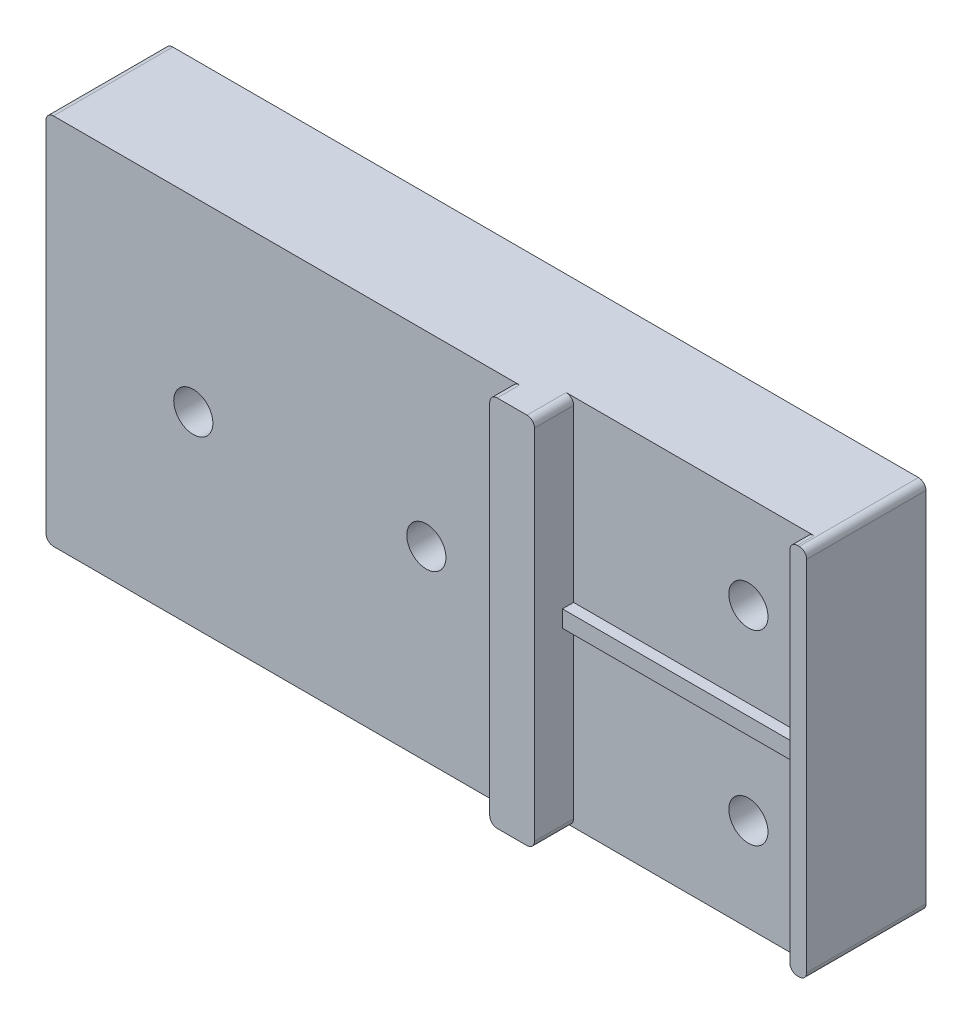
from build123d import *

# Parameters (mm, degrees)
BOSS_EXTRUDE1_DEPTH = 40
SKETCH6_R           = 2.1
CUT_EXTRUDE4_DEPTH  = 12.8
CUT_EXTRUDE7_REACH  = 60.186
SKETCH10_R          = 2.1
SKETCH11_R          = 4.75
CUT_EXTRUDE8_DEPTH  = 4.5
BOSS_EXTRUDE2_START = -0.6
SKETCH12_R          = 2.1
BOSS_EXTRUDE2_DEPTH = 0.6
SKETCH13_W          = 25
SKETCH13_H          = 1.8
BOSS_EXTRUDE3_DEPTH = 1.2
FILLET1_R           = 0.8
CUT_EXTRUDE9_DEPTH  = 1.2


with BuildPart() as part:
    # Sketch1 → Boss-Extrude1 (new body)
    with BuildSketch(Plane.XZ):
        Polygon((14, 15.2), (14, 12.8), (14, 11), (39, 11), (39, 12.8), (40.8, 12.8), (40.8, 0), (-40.8, 0), (-40.8, 12.8), (9.2, 12.8), (9.2, 15.2), align=None)
    extrude(amount=BOSS_EXTRUDE1_DEPTH)

    # Sketch6 → Cut-Extrude4 (cut)
    with BuildSketch(Plane(origin=(0, 0, 0), x_dir=(-1, 0, 0), z_dir=(0, 0, -1))):
        with Locations((25, -20)):
            Circle(SKETCH6_R)
        with Locations((0, -20)):
            Circle(SKETCH6_R)
    extrude(amount=-CUT_EXTRUDE4_DEPTH, mode=Mode.SUBTRACT)

    # Sketch10 → Cut-Extrude7 (cut, up to next)
    with BuildSketch(Plane.XY.offset(11), mode=Mode.PRIVATE) as cut_extrude7_sk1:
        with Locations((32.75, -10)):
            Circle(SKETCH10_R)
    cut_extrude7_tool1 = extrude(cut_extrude7_sk1.sketch, amount=-CUT_EXTRUDE7_REACH, mode=Mode.PRIVATE) & part.part
    # Sketch10 → Cut-Extrude7 (cut, up to next)
    with BuildSketch(Plane.XY.offset(11), mode=Mode.PRIVATE) as cut_extrude7_sk2:
        with Locations((32.75, -30)):
            Circle(SKETCH10_R)
    cut_extrude7_tool2 = extrude(cut_extrude7_sk2.sketch, amount=-CUT_EXTRUDE7_REACH, mode=Mode.PRIVATE) & part.part
    add(cut_extrude7_tool1.solids().sort_by_distance((32.75, -10, 11))[0], mode=Mode.SUBTRACT)
    add(cut_extrude7_tool2.solids().sort_by_distance((32.75, -30, 11))[0], mode=Mode.SUBTRACT)

    # Sketch11 → Cut-Extrude8 (cut)
    with BuildSketch(Plane(origin=(0, 0, 0), x_dir=(-1, 0, 0), z_dir=(0, 0, -1))):
        with Locations((-32.75, -10)):
            Circle(SKETCH11_R)
        with Locations((-32.75, -30)):
            Circle(SKETCH11_R)
    extrude(amount=-CUT_EXTRUDE8_DEPTH, mode=Mode.SUBTRACT)

    # Sketch12 → Boss-Extrude2 (add)
    with BuildSketch(Plane(origin=(0, 0, 4.5), x_dir=(-1, 0, 0), z_dir=(0, 0, -1)).offset(BOSS_EXTRUDE2_START)):
        with Locations(Location((-32.75, -10, 0), (0, 0, 180))):
            Circle(SKETCH12_R)
        with Locations(Location((-32.75, -30, 0), (0, 0, 180))):
            Circle(SKETCH12_R)
    extrude(amount=BOSS_EXTRUDE2_DEPTH)

    # Sketch13 → Boss-Extrude3 (add)
    with BuildSketch(Plane.XY.offset(11)):
        with Locations((26.5, -20)):
            Rectangle(SKETCH13_W, SKETCH13_H)
    extrude(amount=BOSS_EXTRUDE3_DEPTH)

    # Fillet1
    fillet1_edges = [part.edges().sort_by_distance(p)[0] for p in [
        (39, 0, 11.9),
        (40.8, 0, 6.4),
        (-40.8, 0, 6.4),
        (9.2, 0, 14),
        (14, 0, 13.1),
        (9.2, -40, 14),
        (-40.8, -40, 6.4),
        (40.8, -40, 6.4),
        (39, -40, 11.9),
        (14, -40, 13.1),
    ]]
    fillet(fillet1_edges, radius=FILLET1_R)

    # Sketch14 → Cut-Extrude9 (cut)
    # profile 1 of 7: a face of its own
    with BuildSketch(Plane(origin=(0, 0, 0), x_dir=(-1, 0, 0), z_dir=(0, 0, -1))):
        with BuildLine():
            Line((2.18974359, -30.674379006), (1.98291266, -31.008814103))
            Line((1.98291266, -31.008814103), (0.630448718, -30.07421875))
            add(Edge.make_bspline(
                [(0.630448718, -30.07421875), (0.635713379, -30.096820612), (0.64670946, -30.144028187), (0.65664749, -30.219579036), (0.663018687, -30.301970696), (0.663732838, -30.359327882), (0.664102564, -30.389022436)],
                knots=[0, 0, 0, 0, 0.876990432, 1.831733655, 2.877460594, 4, 4, 4, 4], degree=3))
            add(Edge.make_bspline(
                [(0.664102564, -30.389022436), (0.663115444, -30.425990318), (0.661165255, -30.499025386), (0.647037, -30.606370258), (0.623220845, -30.709512524), (0.589235967, -30.808018938), (0.546419443, -30.90261282), (0.493470997, -30.992789688), (0.430661162, -31.078459827), (0.359582792, -31.159169734), (0.281993022, -31.233367561), (0.197759499, -31.297134159), (0.110227056, -31.352569561), (0.017438548, -31.396534719), (-0.078996498, -31.43238234), (-0.180506278, -31.456397832), (-0.286383613, -31.471711294), (-0.35854579, -31.473465627), (-0.395292468, -31.474358974)],
                knots=[0, 0, 0, 0, 1.049645559, 2.073717244, 3.068620023, 4.050868799, 5.0280146, 6.012614837, 7.014861962, 8.040029866, 9.063477688, 10.05771615, 11.035582925, 12.000321245, 12.968227545, 13.951753526, 14.956984712, 16, 16, 16, 16], degree=3))
            add(Edge.make_bspline(
                [(-0.395292468, -31.474358974), (-0.445437008, -31.472684855), (-0.543929321, -31.469396603), (-0.687582758, -31.441138346), (-0.823559409, -31.39549398), (-0.95080497, -31.33120542), (-1.068581476, -31.250659696), (-1.17328114, -31.152836724), (-1.26646831, -31.040663752), (-1.345169464, -30.914477232), (-1.409973743, -30.778748596), (-1.455099856, -30.635905851), (-1.484898227, -30.488881079), (-1.488119467, -30.388934103), (-1.48974359, -30.338541667)],
                knots=[0, 0, 0, 0, 1.026456071, 2.016132398, 2.986618949, 3.956550292, 4.927332038, 5.899659137, 6.882304236, 7.906435223, 8.938725503, 9.954676794, 10.968765, 12, 12, 12, 12], degree=3))
            add(Edge.make_bspline(
                [(-1.48974359, -30.338541667), (-1.48808912, -30.285831713), (-1.484822045, -30.181745547), (-1.455898624, -30.02918493), (-1.408490139, -29.883478063), (-1.343562104, -29.745818699), (-1.262466304, -29.618850891), (-1.167035571, -29.50621346), (-1.05799344, -29.409178295), (-0.936995118, -29.329235031), (-0.808120194, -29.265898381), (-0.67494459, -29.219628437), (-0.538827281, -29.191184244), (-0.446840056, -29.1876583), (-0.400901442, -29.185897436)],
                knots=[0, 0, 0, 0, 1.075197932, 2.123189704, 3.15662753, 4.195917961, 5.22152995, 6.223331757, 7.199928194, 8.190971749, 9.174546411, 10.12353229, 11.062888073, 12, 12, 12, 12], degree=3))
            add(Edge.make_bspline(
                [(-0.400901442, -29.185897436), (-0.365102769, -29.18715092), (-0.292492595, -29.189693353), (-0.182410662, -29.205186369), (-0.070740089, -29.233683557), (0.024403069, -29.263889611), (0.102726283, -29.295596851), (0.166353593, -29.323601702), (0.23313902, -29.357498353), (0.303938195, -29.395413695), (0.378676974, -29.43730524), (0.456119285, -29.485579567), (0.53836492, -29.537016701), (0.593627626, -29.574157224), (0.622035256, -29.593249199)],
                knots=[0, 0, 0, 0, 1.15294581, 2.338511124, 3.570504003, 4.860343612, 5.549269519, 6.290426943, 7.098128343, 7.959998524, 8.876605184, 9.856197529, 10.897984707, 12, 12, 12, 12], degree=3))
            Line((0.622035256, -29.593249199), (2.18974359, -30.674379006))
        make_face()
        with BuildLine():
            add(Edge.make_bspline(
                [(0.26025641, -30.32802484), (0.259884415, -30.302745208), (0.259158039, -30.253383039), (0.248583868, -30.181189733), (0.233427664, -30.112670976), (0.212796083, -30.047410044), (0.183852135, -29.986852156), (0.150660929, -29.929023796), (0.110099805, -29.875403795), (0.064089045, -29.826052723), (0.013728681, -29.78138135), (-0.039416918, -29.741957459), (-0.09542294, -29.708855301), (-0.153558075, -29.680897222), (-0.215148763, -29.661260794), (-0.278466864, -29.645261459), (-0.344773559, -29.636038256), (-0.389889836, -29.635094868), (-0.412820513, -29.634615385)],
                knots=[0, 0, 0, 0, 1.121582496, 2.190053483, 3.232400525, 4.236647434, 5.220963389, 6.207028463, 7.192929689, 8.198944593, 9.198677044, 10.178386704, 11.132364257, 12.084081197, 13.035798136, 13.997310019, 14.982118228, 16, 16, 16, 16], degree=3))
            add(Edge.make_bspline(
                [(-0.412820513, -29.634615385), (-0.435527521, -29.635320878), (-0.480452476, -29.636716671), (-0.546442508, -29.646853131), (-0.610082036, -29.662680758), (-0.670741042, -29.686368736), (-0.729435435, -29.715830435), (-0.78545275, -29.752499033), (-0.838952878, -29.795505151), (-0.889111398, -29.844399914), (-0.934815185, -29.897713994), (-0.975282045, -29.954422985), (-1.009922794, -30.013803953), (-1.037042806, -30.076886463), (-1.059064422, -30.142004224), (-1.074258241, -30.210168348), (-1.084734309, -30.280957759), (-1.085505863, -30.329387623), (-1.085897436, -30.353966346)],
                knots=[0, 0, 0, 0, 0.994937709, 1.968446594, 2.919989092, 3.863558558, 4.816423409, 5.793804831, 6.792059096, 7.820701382, 8.859544826, 9.865755936, 10.870767095, 11.866126566, 12.870302131, 13.879168912, 14.923653358, 16, 16, 16, 16], degree=3))
            add(Edge.make_bspline(
                [(-1.085897436, -30.353966346), (-1.08544209, -30.37597158), (-1.084541858, -30.419476575), (-1.074846763, -30.483500983), (-1.060481242, -30.545649432), (-1.038896302, -30.60553683), (-1.012568595, -30.663705172), (-0.979710812, -30.719691913), (-0.941350245, -30.773732765), (-0.896575341, -30.824322731), (-0.847786157, -30.871256831), (-0.79546549, -30.912834), (-0.739207063, -30.947301416), (-0.680358914, -30.976629924), (-0.617425323, -30.997794396), (-0.552142471, -31.014462771), (-0.483406568, -31.02333352), (-0.436680597, -31.024861023), (-0.412820513, -31.025641026)],
                knots=[0, 0, 0, 0, 0.997045996, 1.971189291, 2.929935883, 3.885161974, 4.852537692, 5.821305485, 6.824079419, 7.852889404, 8.879732673, 9.89098216, 10.876130483, 11.866678787, 12.865412881, 13.880652408, 14.917779329, 16, 16, 16, 16], degree=3))
            add(Edge.make_bspline(
                [(-0.412820513, -31.025641026), (-0.388944946, -31.024951997), (-0.342156426, -31.023601721), (-0.273832448, -31.013469387), (-0.208545176, -30.997624113), (-0.146908135, -30.973830124), (-0.08711629, -30.945687764), (-0.032086709, -30.908245522), (0.021289132, -30.866455217), (0.069482215, -30.817157277), (0.114420681, -30.76462836), (0.152628333, -30.708251054), (0.186223979, -30.650376355), (0.213388669, -30.59023554), (0.234919858, -30.527867166), (0.249198706, -30.463144913), (0.258900738, -30.396326966), (0.259801121, -30.350963429), (0.26025641, -30.32802484)],
                knots=[0, 0, 0, 0, 1.061891236, 2.080969146, 3.067046533, 4.044312597, 5.016253526, 5.999695806, 6.998411536, 8.02778209, 9.060927085, 10.070410951, 11.05319335, 12.035095218, 13.00184945, 13.983090402, 14.980126661, 16, 16, 16, 16], degree=3))
        make_face(mode=Mode.SUBTRACT)
    # profile 2 of 7: a face of its own
    with BuildSketch(Plane(origin=(0, 0, 0), x_dir=(-1, 0, 0), z_dir=(0, 0, -1))):
        with BuildLine():
            Line((-0.502564103, -13.256410256), (-0.502564103, -12.807692308))
            Line((-0.502564103, -12.807692308), (-0.065765224, -12.807692308))
            add(Edge.make_bspline(
                [(-0.065765224, -12.807692308), (-0.084561407, -12.803382753), (-0.121235771, -12.79497412), (-0.173571558, -12.776458129), (-0.221966924, -12.753837776), (-0.267578259, -12.728092415), (-0.308636362, -12.696807675), (-0.347219493, -12.66258662), (-0.380741335, -12.622967627), (-0.400219463, -12.59426418), (-0.410016026, -12.579827724)],
                knots=[0, 0, 0, 0, 1.08898891, 2.124791909, 3.129224238, 4.105481065, 5.077441123, 6.040388005, 7.014409297, 8, 8, 8, 8], degree=3))
            add(Edge.make_bspline(
                [(-0.410016026, -12.579827724), (-0.431302761, -12.536374137), (-0.473332639, -12.450576622), (-0.515082681, -12.314878959), (-0.542899025, -12.177591481), (-0.545921401, -12.084972535), (-0.547435897, -12.038561699)],
                knots=[0, 0, 0, 0, 1.028471117, 2.030678542, 3.013184023, 4, 4, 4, 4], degree=3))
            add(Edge.make_bspline(
                [(-0.547435897, -12.038561699), (-0.546565379, -12.004380739), (-0.544839075, -11.936597264), (-0.528744481, -11.836230933), (-0.502873127, -11.738753956), (-0.467166835, -11.645085666), (-0.423355583, -11.557702768), (-0.373850793, -11.477920194), (-0.317729935, -11.407692207), (-0.256282291, -11.346115791), (-0.187390861, -11.294949973), (-0.111954305, -11.254602465), (-0.029032517, -11.225978863), (0.029160708, -11.216238328), (0.059034455, -11.211237981)],
                knots=[0, 0, 0, 0, 1.099015544, 2.179432478, 3.260947688, 4.338981182, 5.398181099, 6.40160478, 7.353922011, 8.284349489, 9.192639792, 10.104191918, 11.026778618, 12, 12, 12, 12], degree=3))
            add(Edge.make_bspline(
                [(0.059034455, -11.211237981), (0.036012614, -11.203139246), (-0.009510895, -11.187124764), (-0.075095081, -11.157840076), (-0.136309906, -11.122365798), (-0.19397331, -11.082249), (-0.248440257, -11.037480327), (-0.29781476, -10.986463263), (-0.344852266, -10.931811799), (-0.386084901, -10.871544117), (-0.423909068, -10.808854922), (-0.456883554, -10.744170446), (-0.485143508, -10.678464872), (-0.507349718, -10.611208711), (-0.526039748, -10.543265369), (-0.538610739, -10.473584847), (-0.545455188, -10.402748768), (-0.546774398, -10.355181871), (-0.547435897, -10.331330128)],
                knots=[0, 0, 0, 0, 1.024672991, 2.026193794, 3.01103273, 3.991165591, 4.973850373, 5.96628909, 6.969107479, 7.9982829, 9.028393851, 10.042340945, 11.044967205, 12.028827566, 13.014448664, 14.002022455, 14.998142625, 16, 16, 16, 16], degree=3))
            add(Edge.make_bspline(
                [(-0.547435897, -10.331330128), (-0.547118946, -10.30700382), (-0.54649584, -10.259179941), (-0.538978002, -10.188726353), (-0.528135862, -10.120452448), (-0.511805201, -10.054692333), (-0.491610449, -9.991029745), (-0.466028936, -9.930069177), (-0.436910914, -9.870888884), (-0.390877172, -9.796731364), (-0.325893801, -9.710903411), (-0.233287584, -9.623136702), (-0.12991704, -9.549847209), (-0.033662213, -9.502188869), (0.050821648, -9.471833338), (0.121734938, -9.451435992), (0.199838902, -9.43504378), (0.284710088, -9.420856404), (0.376954247, -9.410684833), (0.476103905, -9.403156063), (0.582484283, -9.397964137), (0.655682543, -9.397615998), (0.693549679, -9.397435897)],
                knots=[0, 0, 0, 0, 0.823332918, 1.618616861, 2.396586156, 3.162386254, 3.910649777, 4.655726331, 5.398909421, 6.1412916, 7.608533871, 9.030212322, 10.444139297, 11.884503253, 12.650507755, 13.48205207, 14.380733726, 15.351243431, 16.394668736, 17.521733916, 18.717936206, 20, 20, 20, 20], degree=3))
            Line((0.693549679, -9.397435897), (2.1, -9.397435897))
            Line((2.1, -9.397435897), (2.1, -9.846153846))
            Line((2.1, -9.846153846), (0.694951923, -9.846153846))
            add(Edge.make_bspline(
                [(0.694951923, -9.846153846), (0.663632459, -9.846210026), (0.603550136, -9.846317798), (0.517529472, -9.849279698), (0.439453936, -9.853440138), (0.369250614, -9.858686295), (0.306817176, -9.866439049), (0.252077538, -9.875486504), (0.204982179, -9.885355205), (0.153496544, -9.902355235), (0.097225591, -9.928919857), (0.037097223, -9.97040221), (-0.01572039, -10.02144683), (-0.061452981, -10.081047711), (-0.097840954, -10.148815206), (-0.124928555, -10.223064944), (-0.140223655, -10.30406884), (-0.142445571, -10.360013479), (-0.143589744, -10.388822115)],
                knots=[0, 0, 0, 0, 1.305595988, 2.50461634, 3.587666171, 4.565077188, 5.438800553, 6.209235777, 6.878175067, 7.442006767, 8.466179135, 9.460727197, 10.473669419, 11.516214057, 12.579940716, 13.667887689, 14.799081087, 16, 16, 16, 16], degree=3))
            add(Edge.make_bspline(
                [(-0.143589744, -10.388822115), (-0.142113515, -10.42098096), (-0.139155014, -10.485430317), (-0.114810071, -10.580040774), (-0.076471007, -10.671748995), (-0.023200841, -10.759089881), (0.044007416, -10.839521614), (0.124050377, -10.910715905), (0.21759041, -10.969466375), (0.304541433, -11.010951778), (0.384043777, -11.037734449), (0.454528591, -11.054645384), (0.53443053, -11.070422865), (0.624456384, -11.081482457), (0.724213226, -11.091851906), (0.833965547, -11.097292576), (0.95362617, -11.101942999), (1.036626025, -11.102351355), (1.079867788, -11.102564103)],
                knots=[0, 0, 0, 0, 0.965918169, 1.935791113, 2.918614482, 3.946728758, 4.999527746, 6.059992734, 7.153658271, 8.310614728, 8.948450525, 9.672867845, 10.488828659, 11.396296474, 12.399093975, 13.50428262, 14.699766169, 16, 16, 16, 16], degree=3))
            Line((1.079867788, -11.102564103), (2.1, -11.102564103))
            Line((2.1, -11.102564103), (2.1, -11.551282051))
            Line((2.1, -11.551282051), (0.77978766, -11.551282051))
            add(Edge.make_bspline(
                [(0.77978766, -11.551282051), (0.744495369, -11.551335738), (0.676936358, -11.55143851), (0.580168164, -11.554421571), (0.492509317, -11.55854177), (0.413675389, -11.563847467), (0.343978743, -11.571453023), (0.283190454, -11.580646964), (0.231411437, -11.590363353), (0.175615625, -11.60733233), (0.114484375, -11.633283705), (0.04965192, -11.674891987), (-0.007414241, -11.726474816), (-0.05635913, -11.786599061), (-0.095957495, -11.854587986), (-0.123165416, -11.929686112), (-0.140683222, -12.010411297), (-0.142602859, -12.066511485), (-0.143589744, -12.095352564)],
                knots=[0, 0, 0, 0, 1.376758737, 2.635489419, 3.77647752, 4.80022883, 5.717469035, 6.510473873, 7.19888343, 7.770014609, 8.782826871, 9.779297374, 10.760594766, 11.771599753, 12.792790105, 13.814021158, 14.876189361, 16, 16, 16, 16], degree=3))
            add(Edge.make_bspline(
                [(-0.143589744, -12.095352564), (-0.141964874, -12.126080072), (-0.138700162, -12.187818263), (-0.116361596, -12.279451167), (-0.077799777, -12.368496924), (-0.027519973, -12.456072102), (0.038344183, -12.536886041), (0.117410039, -12.608864335), (0.20951558, -12.669844033), (0.295929376, -12.712066851), (0.373538647, -12.739815087), (0.440492172, -12.75754318), (0.514763035, -12.773993402), (0.597038112, -12.786104302), (0.686846151, -12.795898969), (0.784375388, -12.80272175), (0.889591977, -12.806962483), (0.962308679, -12.807443421), (0.999939904, -12.807692308)],
                knots=[0, 0, 0, 0, 0.973894388, 1.956763917, 2.96941869, 4.041797769, 5.147885003, 6.25966368, 7.418502335, 8.637782007, 9.298570163, 10.028234491, 10.831780649, 11.70874194, 12.662651334, 13.69505766, 14.807181832, 16, 16, 16, 16], degree=3))
            Line((0.999939904, -12.807692308), (2.1, -12.807692308))
            Line((2.1, -12.807692308), (2.1, -13.256410256))
            Line((2.1, -13.256410256), (-0.502564103, -13.256410256))
        make_face()
    # profile 3 of 7: a face of its own
    with BuildSketch(Plane(origin=(0, 0, 0), x_dir=(-1, 0, 0), z_dir=(0, 0, -1))):
        with BuildLine():
            Line((-0.502564103, -8.679487179), (-0.502564103, -8.230769231))
            Line((-0.502564103, -8.230769231), (-0.065765224, -8.230769231))
            add(Edge.make_bspline(
                [(-0.065765224, -8.230769231), (-0.084561407, -8.226459676), (-0.121235771, -8.218051043), (-0.173571558, -8.199535052), (-0.221966924, -8.176914699), (-0.267578259, -8.151169338), (-0.308636362, -8.119884598), (-0.347219493, -8.085663543), (-0.380741335, -8.04604455), (-0.400219463, -8.017341103), (-0.410016026, -8.002904647)],
                knots=[0, 0, 0, 0, 1.08898891, 2.124791909, 3.129224238, 4.105481065, 5.077441123, 6.040388005, 7.014409297, 8, 8, 8, 8], degree=3))
            add(Edge.make_bspline(
                [(-0.410016026, -8.002904647), (-0.431302761, -7.95945106), (-0.473332639, -7.873653545), (-0.515082681, -7.737955882), (-0.542899025, -7.600668404), (-0.545921401, -7.508049458), (-0.547435897, -7.461638622)],
                knots=[0, 0, 0, 0, 1.028471117, 2.030678542, 3.013184023, 4, 4, 4, 4], degree=3))
            add(Edge.make_bspline(
                [(-0.547435897, -7.461638622), (-0.546565379, -7.427457662), (-0.544839075, -7.359674187), (-0.528744481, -7.259307856), (-0.502873127, -7.161830879), (-0.467166835, -7.068162589), (-0.423355583, -6.980779691), (-0.373850793, -6.900997117), (-0.317729935, -6.83076913), (-0.256282291, -6.769192714), (-0.187390861, -6.718026896), (-0.111954305, -6.677679388), (-0.029032517, -6.649055787), (0.029160708, -6.639315251), (0.059034455, -6.634314904)],
                knots=[0, 0, 0, 0, 1.099015544, 2.179432478, 3.260947688, 4.338981182, 5.398181099, 6.40160478, 7.353922011, 8.284349489, 9.192639792, 10.104191918, 11.026778618, 12, 12, 12, 12], degree=3))
            add(Edge.make_bspline(
                [(0.059034455, -6.634314904), (0.036012614, -6.626216169), (-0.009510895, -6.610201687), (-0.075095081, -6.580916999), (-0.136309906, -6.545442721), (-0.19397331, -6.505325923), (-0.248440257, -6.46055725), (-0.29781476, -6.409540186), (-0.344852266, -6.354888722), (-0.386084901, -6.29462104), (-0.423909068, -6.231931845), (-0.456883554, -6.167247369), (-0.485143508, -6.101541795), (-0.507349718, -6.034285634), (-0.526039748, -5.966342292), (-0.538610739, -5.89666177), (-0.545455188, -5.825825691), (-0.546774398, -5.778258794), (-0.547435897, -5.754407051)],
                knots=[0, 0, 0, 0, 1.024672991, 2.026193794, 3.01103273, 3.991165591, 4.973850373, 5.96628909, 6.969107479, 7.9982829, 9.028393851, 10.042340945, 11.044967205, 12.028827566, 13.014448664, 14.002022455, 14.998142625, 16, 16, 16, 16], degree=3))
            add(Edge.make_bspline(
                [(-0.547435897, -5.754407051), (-0.547118946, -5.730080743), (-0.54649584, -5.682256864), (-0.538978002, -5.611803276), (-0.528135862, -5.543529371), (-0.511805201, -5.477769256), (-0.491610449, -5.414106669), (-0.466028936, -5.3531461), (-0.436910914, -5.293965807), (-0.390877172, -5.219808287), (-0.325893801, -5.133980334), (-0.233287584, -5.046213625), (-0.12991704, -4.972924132), (-0.033662213, -4.925265792), (0.050821648, -4.894910261), (0.121734938, -4.874512915), (0.199838902, -4.858120703), (0.284710088, -4.843933327), (0.376954247, -4.833761756), (0.476103905, -4.826232986), (0.582484283, -4.82104106), (0.655682543, -4.820692921), (0.693549679, -4.820512821)],
                knots=[0, 0, 0, 0, 0.823332918, 1.618616861, 2.396586156, 3.162386254, 3.910649777, 4.655726331, 5.398909421, 6.1412916, 7.608533871, 9.030212322, 10.444139297, 11.884503253, 12.650507755, 13.48205207, 14.380733726, 15.351243431, 16.394668736, 17.521733916, 18.717936206, 20, 20, 20, 20], degree=3))
            Line((0.693549679, -4.820512821), (2.1, -4.820512821))
            Line((2.1, -4.820512821), (2.1, -5.269230769))
            Line((2.1, -5.269230769), (0.694951923, -5.269230769))
            add(Edge.make_bspline(
                [(0.694951923, -5.269230769), (0.663632459, -5.269286949), (0.603550136, -5.269394721), (0.517529472, -5.272356621), (0.439453936, -5.276517061), (0.369250614, -5.281763218), (0.306817176, -5.289515972), (0.252077538, -5.298563428), (0.204982179, -5.308432128), (0.153496544, -5.325432158), (0.097225591, -5.35199678), (0.037097223, -5.393479134), (-0.01572039, -5.444523753), (-0.061452981, -5.504124634), (-0.097840954, -5.571892129), (-0.124928555, -5.646141867), (-0.140223655, -5.727145763), (-0.142445571, -5.783090402), (-0.143589744, -5.811899038)],
                knots=[0, 0, 0, 0, 1.305595988, 2.50461634, 3.587666171, 4.565077188, 5.438800553, 6.209235777, 6.878175067, 7.442006767, 8.466179135, 9.460727197, 10.473669419, 11.516214057, 12.579940716, 13.667887689, 14.799081087, 16, 16, 16, 16], degree=3))
            add(Edge.make_bspline(
                [(-0.143589744, -5.811899038), (-0.142113515, -5.844057883), (-0.139155014, -5.90850724), (-0.114810071, -6.003117697), (-0.076471007, -6.094825918), (-0.023200841, -6.182166804), (0.044007416, -6.262598537), (0.124050377, -6.333792828), (0.21759041, -6.392543298), (0.304541433, -6.434028701), (0.384043777, -6.460811372), (0.454528591, -6.477722307), (0.53443053, -6.493499788), (0.624456384, -6.50455938), (0.724213226, -6.514928829), (0.833965547, -6.520369499), (0.95362617, -6.525019922), (1.036626025, -6.525428278), (1.079867788, -6.525641026)],
                knots=[0, 0, 0, 0, 0.965918169, 1.935791113, 2.918614482, 3.946728758, 4.999527746, 6.059992734, 7.153658271, 8.310614728, 8.948450525, 9.672867845, 10.488828659, 11.396296474, 12.399093975, 13.50428262, 14.699766169, 16, 16, 16, 16], degree=3))
            Line((1.079867788, -6.525641026), (2.1, -6.525641026))
            Line((2.1, -6.525641026), (2.1, -6.974358974))
            Line((2.1, -6.974358974), (0.77978766, -6.974358974))
            add(Edge.make_bspline(
                [(0.77978766, -6.974358974), (0.744495369, -6.974412661), (0.676936358, -6.974515433), (0.580168164, -6.977498494), (0.492509317, -6.981618693), (0.413675389, -6.98692439), (0.343978743, -6.994529946), (0.283190454, -7.003723887), (0.231411437, -7.013440276), (0.175615625, -7.030409253), (0.114484375, -7.056360628), (0.04965192, -7.09796891), (-0.007414241, -7.149551739), (-0.05635913, -7.209675984), (-0.095957495, -7.277664909), (-0.123165416, -7.352763035), (-0.140683222, -7.43348822), (-0.142602859, -7.489588408), (-0.143589744, -7.518429487)],
                knots=[0, 0, 0, 0, 1.376758737, 2.635489419, 3.77647752, 4.80022883, 5.717469035, 6.510473873, 7.19888343, 7.770014609, 8.782826871, 9.779297374, 10.760594766, 11.771599753, 12.792790105, 13.814021158, 14.876189361, 16, 16, 16, 16], degree=3))
            add(Edge.make_bspline(
                [(-0.143589744, -7.518429487), (-0.141964874, -7.549156995), (-0.138700162, -7.610895186), (-0.116361596, -7.70252809), (-0.077799777, -7.791573847), (-0.027519973, -7.879149025), (0.038344183, -7.959962964), (0.117410039, -8.031941258), (0.20951558, -8.092920956), (0.295929376, -8.135143774), (0.373538647, -8.16289201), (0.440492172, -8.180620103), (0.514763035, -8.197070325), (0.597038112, -8.209181225), (0.686846151, -8.218975892), (0.784375388, -8.225798673), (0.889591977, -8.230039406), (0.962308679, -8.230520344), (0.999939904, -8.230769231)],
                knots=[0, 0, 0, 0, 0.973894388, 1.956763917, 2.96941869, 4.041797769, 5.147885003, 6.25966368, 7.418502335, 8.637782007, 9.298570163, 10.028234491, 10.831780649, 11.70874194, 12.662651334, 13.69505766, 14.807181832, 16, 16, 16, 16], degree=3))
            Line((0.999939904, -8.230769231), (2.1, -8.230769231))
            Line((2.1, -8.230769231), (2.1, -8.679487179))
            Line((2.1, -8.679487179), (-0.502564103, -8.679487179))
        make_face()
    # profile 4 of 7: a face of its own
    with BuildSketch(Plane(origin=(0, 0, 0), x_dir=(-1, 0, 0), z_dir=(0, 0, -1))):
        with BuildLine():
            Line((24.452564103, -32.345152244), (24.452564103, -32.775641026))
            add(Edge.make_bspline(
                [(24.452564103, -32.775641026), (24.413849082, -32.766868355), (24.338065087, -32.749696001), (24.229838275, -32.714913788), (24.128696695, -32.676047748), (24.035588595, -32.630203441), (23.950279446, -32.578474365), (23.872157323, -32.521484431), (23.802582131, -32.458054892), (23.740590963, -32.389203434), (23.686999172, -32.31535979), (23.639582252, -32.238632461), (23.599415907, -32.158712111), (23.567395147, -32.075153119), (23.54073743, -31.989174235), (23.524038505, -31.899254676), (23.511947776, -31.806785322), (23.510824548, -31.743864937), (23.51025641, -31.712039263)],
                knots=[0, 0, 0, 0, 1.22526368, 2.398432785, 3.506746844, 4.568598436, 5.59835315, 6.584206595, 7.549776116, 8.500314391, 9.439996572, 10.363352712, 11.283176761, 12.197178631, 13.124137687, 14.058260885, 15.01785159, 16, 16, 16, 16], degree=3))
            add(Edge.make_bspline(
                [(23.51025641, -31.712039263), (23.511821058, -31.662612951), (23.514919343, -31.56473997), (23.541251098, -31.420995016), (23.582535601, -31.28222487), (23.640632752, -31.150931854), (23.71123376, -31.029425239), (23.793731764, -30.921976175), (23.885959416, -30.829618779), (23.988091696, -30.754637751), (24.095488267, -30.696129189), (24.205374521, -30.653186551), (24.316933478, -30.626769708), (24.392131706, -30.623444196), (24.429427083, -30.621794872)],
                knots=[0, 0, 0, 0, 1.126650628, 2.230970716, 3.322152374, 4.422579687, 5.497796547, 6.520355121, 7.504217356, 8.464885716, 9.400040405, 10.28608736, 11.149966435, 12, 12, 12, 12], degree=3))
            add(Edge.make_bspline(
                [(24.429427083, -30.621794872), (24.465740056, -30.6229416), (24.536778991, -30.625184939), (24.640048292, -30.644691215), (24.73692499, -30.676056326), (24.827006936, -30.720924627), (24.910474511, -30.778104651), (24.986606848, -30.84865081), (25.056791339, -30.931170045), (25.096240261, -30.993558459), (25.116526442, -31.025641026)],
                knots=[0, 0, 0, 0, 1.039530957, 2.033630564, 2.999111873, 3.948297759, 4.906578666, 5.887513816, 6.913676835, 8, 8, 8, 8], degree=3))
            add(Edge.make_bspline(
                [(25.116526442, -31.025641026), (25.131379393, -30.990974514), (25.161016424, -30.921802234), (25.224199619, -30.827649401), (25.299604422, -30.741096954), (25.35948977, -30.692697961), (25.389963942, -30.66806891)],
                knots=[0, 0, 0, 0, 0.990740455, 1.976887035, 2.970487876, 4, 4, 4, 4], degree=3))
            add(Edge.make_bspline(
                [(25.389963942, -30.66806891), (25.414749446, -30.650222318), (25.463705303, -30.614972068), (25.540169204, -30.568210655), (25.619018404, -30.530200395), (25.698263501, -30.497170634), (25.779387196, -30.472778374), (25.861680924, -30.455201981), (25.945427386, -30.444303899), (26.001777372, -30.442975229), (26.030088141, -30.442307692)],
                knots=[0, 0, 0, 0, 1.060434252, 2.094549648, 3.107169572, 4.097295716, 5.072846837, 6.043796276, 7.017184609, 8, 8, 8, 8], degree=3))
            add(Edge.make_bspline(
                [(26.030088141, -30.442307692), (26.078870605, -30.444073755), (26.176715905, -30.44761603), (26.321398013, -30.480420983), (26.463851344, -30.53103571), (26.577984114, -30.590382808), (26.667227526, -30.6451435), (26.73009385, -30.692664953), (26.790085431, -30.743139266), (26.846282455, -30.797801196), (26.898264791, -30.857087564), (26.946741889, -30.920329928), (26.991689851, -30.987801933), (27.032701636, -31.059082367), (27.070300005, -31.133180532), (27.101361637, -31.210671913), (27.128947579, -31.289863696), (27.151624501, -31.371286181), (27.168019645, -31.455295989), (27.181079197, -31.54132015), (27.187765336, -31.629903166), (27.1890796, -31.68959449), (27.18974359, -31.719751603)],
                knots=[0, 0, 0, 0, 1.522006939, 3.052761468, 4.611534025, 6.23430497, 7.060814796, 7.879972251, 8.693252385, 9.508986549, 10.326287426, 11.154247015, 11.996598656, 12.856888337, 13.722120476, 14.589813288, 15.462559326, 16.341088226, 17.227379173, 18.134945082, 19.057741282, 20, 20, 20, 20], degree=3))
            add(Edge.make_bspline(
                [(27.18974359, -31.719751603), (27.188892438, -31.757874971), (27.18721723, -31.832908034), (27.175317467, -31.942922157), (27.154978188, -32.048254104), (27.126116373, -32.14858296), (27.089754276, -32.244504848), (27.044688334, -32.335396516), (26.991069364, -32.421096321), (26.929957433, -32.502120007), (26.860447317, -32.577839498), (26.780639271, -32.645937577), (26.6916705, -32.706756157), (26.59424464, -32.762280107), (26.486699339, -32.809107655), (26.370635789, -32.850721726), (26.245258749, -32.885316163), (26.157831931, -32.901780037), (26.112820513, -32.91025641)],
                knots=[0, 0, 0, 0, 1.032072894, 2.031289287, 2.991770394, 3.93305173, 4.854342395, 5.765517203, 6.674998765, 7.587424992, 8.509801445, 9.452103048, 10.420947058, 11.423962691, 12.483371376, 13.592138558, 14.760320234, 16, 16, 16, 16], degree=3))
            Line((26.112820513, -32.91025641), (26.112820513, -32.474859776))
            add(Edge.make_bspline(
                [(26.112820513, -32.474859776), (26.142560291, -32.466177298), (26.19954288, -32.449541328), (26.280957784, -32.422340455), (26.354196595, -32.392742035), (26.420372322, -32.363151367), (26.478384333, -32.331275039), (26.528990103, -32.298547025), (26.572523922, -32.264494111), (26.596412601, -32.238884029), (26.6078125, -32.22666266)],
                knots=[0, 0, 0, 0, 1.326235067, 2.541118661, 3.672517805, 4.706670852, 5.642457319, 6.50267409, 7.285462191, 8, 8, 8, 8], degree=3))
            add(Edge.make_bspline(
                [(26.6078125, -32.22666266), (26.622248769, -32.208966866), (26.650840577, -32.17391939), (26.686306351, -32.116249004), (26.717651589, -32.056530642), (26.742832644, -31.99357757), (26.761576279, -31.927677089), (26.775834854, -31.859308438), (26.784299725, -31.787973376), (26.785360826, -31.739405164), (26.785897436, -31.71484375)],
                knots=[0, 0, 0, 0, 0.988971791, 1.958711957, 2.9283992, 3.910445005, 4.891549701, 5.894946261, 6.935453968, 8, 8, 8, 8], degree=3))
            add(Edge.make_bspline(
                [(26.785897436, -31.71484375), (26.785179518, -31.684438209), (26.783772976, -31.624867761), (26.774112117, -31.538010087), (26.757111647, -31.455654964), (26.733498784, -31.378147452), (26.703097134, -31.305035087), (26.665930831, -31.236745287), (26.621501488, -31.17342167), (26.570989017, -31.115641365), (26.516733633, -31.063085899), (26.458868318, -31.01755092), (26.39960729, -30.978034157), (26.33763087, -30.945819767), (26.273276688, -30.921567374), (26.206829633, -30.903856464), (26.138187774, -30.892955456), (26.091593275, -30.891675274), (26.067948718, -30.891025641)],
                knots=[0, 0, 0, 0, 1.197057748, 2.345272073, 3.435232051, 4.503419271, 5.530429872, 6.547499824, 7.558349106, 8.569365886, 9.565024984, 10.527829217, 11.464423711, 12.365684798, 13.271397048, 14.166389318, 15.069527253, 16, 16, 16, 16], degree=3))
            add(Edge.make_bspline(
                [(26.067948718, -30.891025641), (26.036756477, -30.892422463), (25.974414107, -30.895214222), (25.882722497, -30.9163359), (25.793692669, -30.950469952), (25.709215759, -30.998033452), (25.630336618, -31.056354906), (25.562074322, -31.12678149), (25.503080591, -31.206278743), (25.462384295, -31.280733028), (25.435432074, -31.348151384), (25.416774748, -31.406964212), (25.39980831, -31.473628362), (25.38668066, -31.54832252), (25.372590548, -31.63040022), (25.362705056, -31.720796601), (25.354303217, -31.819229896), (25.350088841, -31.887542514), (25.347896635, -31.923076923)],
                knots=[0, 0, 0, 0, 1.058729579, 2.11602981, 3.178917342, 4.287621439, 5.398936793, 6.499140139, 7.605710935, 8.753014912, 9.36916683, 10.069554654, 10.847353893, 11.703624695, 12.644533302, 13.675430424, 14.79082069, 16, 16, 16, 16], degree=3))
            Line((25.347896635, -31.923076923), (24.946153846, -31.923076923))
            add(Edge.make_bspline(
                [(24.946153846, -31.923076923), (24.945278375, -31.876763591), (24.943597735, -31.787855937), (24.929029917, -31.66009788), (24.904034766, -31.544066322), (24.86973605, -31.440104888), (24.828603803, -31.34864085), (24.78205517, -31.270461873), (24.730433802, -31.205879258), (24.67389151, -31.155191776), (24.613159292, -31.118151269), (24.551161077, -31.089553685), (24.48532361, -31.074087308), (24.440716049, -31.071711529), (24.418209135, -31.070512821)],
                knots=[0, 0, 0, 0, 1.497408153, 2.874572874, 4.150970949, 5.329259286, 6.408247028, 7.388160262, 8.264001931, 9.072419529, 9.829497858, 10.556986937, 11.271922258, 12, 12, 12, 12], degree=3))
            add(Edge.make_bspline(
                [(24.418209135, -31.070512821), (24.401575999, -31.071022081), (24.368791998, -31.072025835), (24.32035083, -31.080964394), (24.273426347, -31.094739713), (24.228121822, -31.114791345), (24.184468807, -31.139981159), (24.142850473, -31.171582583), (24.102150864, -31.207815397), (24.063932949, -31.249682382), (24.029173923, -31.295808515), (23.997892617, -31.345015712), (23.972050187, -31.397759956), (23.950986279, -31.453703455), (23.934093517, -31.512517092), (23.922240491, -31.57469236), (23.915108806, -31.639888016), (23.914442072, -31.684443394), (23.914102564, -31.70713141)],
                knots=[0, 0, 0, 0, 0.884957072, 1.74425517, 2.614388382, 3.483720326, 4.375910193, 5.291825137, 6.261215088, 7.27411998, 8.304532511, 9.333441009, 10.374172129, 11.425783428, 12.51294704, 13.628305872, 14.792311112, 16, 16, 16, 16], degree=3))
            add(Edge.make_bspline(
                [(23.914102564, -31.70713141), (23.915516235, -31.739706893), (23.918278876, -31.803366979), (23.937998269, -31.895928306), (23.972600859, -31.981605202), (24.011038089, -32.048869282), (24.050752192, -32.099377765), (24.088795679, -32.135563488), (24.132518, -32.172508291), (24.183354433, -32.208313392), (24.241019103, -32.243775575), (24.305257539, -32.27841351), (24.37628071, -32.313017035), (24.426513386, -32.334178096), (24.452564103, -32.345152244)],
                knots=[0, 0, 0, 0, 1.306194858, 2.552609175, 3.77270225, 4.999258489, 5.646257517, 6.3421885, 7.100637724, 7.940699181, 8.832895117, 9.814319151, 10.866503684, 12, 12, 12, 12], degree=3))
        make_face()
    # profile 5 of 7: a face of its own
    with BuildSketch(Plane(origin=(0, 0, 0), x_dir=(-1, 0, 0), z_dir=(0, 0, -1))):
        Polygon((23.51025641, -28.286358173), (23.51025641, -28.108974359), (25.888461538, -28.108974359), (25.888461538, -27.705128205), (26.292307692, -27.705128205), (26.292307692, -28.108974359), (27.1, -28.108974359), (27.1, -28.557692308), (26.292307692, -28.557692308), (26.292307692, -30.173076923), align=None)
        Polygon((25.888461538, -28.557692308), (24.496734776, -28.557692308), (25.888461538, -29.448818109), align=None, mode=Mode.SUBTRACT)
    # profile 6 of 7: a face of its own
    with BuildSketch(Plane(origin=(0, 0, 0), x_dir=(-1, 0, 0), z_dir=(0, 0, -1))):
        with BuildLine():
            Line((24.497435897, -13.301282051), (24.497435897, -12.852564103))
            Line((24.497435897, -12.852564103), (24.934234776, -12.852564103))
            add(Edge.make_bspline(
                [(24.934234776, -12.852564103), (24.915438593, -12.848254547), (24.878764229, -12.839845915), (24.826428442, -12.821329924), (24.778033076, -12.798709571), (24.732421741, -12.77296421), (24.691363638, -12.74167947), (24.652780507, -12.707458414), (24.619258665, -12.667839422), (24.599780537, -12.639135975), (24.589983974, -12.624699519)],
                knots=[0, 0, 0, 0, 1.08898891, 2.124791909, 3.129224238, 4.105481065, 5.077441123, 6.040388005, 7.014409297, 8, 8, 8, 8], degree=3))
            add(Edge.make_bspline(
                [(24.589983974, -12.624699519), (24.568697239, -12.581245932), (24.526667361, -12.495448417), (24.484917319, -12.359750754), (24.457100975, -12.222463276), (24.454078599, -12.12984433), (24.452564103, -12.083433494)],
                knots=[0, 0, 0, 0, 1.028471117, 2.030678542, 3.013184023, 4, 4, 4, 4], degree=3))
            add(Edge.make_bspline(
                [(24.452564103, -12.083433494), (24.453434621, -12.049252534), (24.455160925, -11.981469059), (24.471255519, -11.881102728), (24.497126873, -11.783625751), (24.532833165, -11.689957461), (24.576644417, -11.602574563), (24.626149207, -11.522791989), (24.682270065, -11.452564001), (24.743717709, -11.390987586), (24.812609139, -11.339821768), (24.888045695, -11.29947426), (24.970967483, -11.270850658), (25.029160708, -11.261110122), (25.059034455, -11.256109776)],
                knots=[0, 0, 0, 0, 1.099015544, 2.179432478, 3.260947688, 4.338981182, 5.398181099, 6.40160478, 7.353922011, 8.284349489, 9.192639792, 10.104191918, 11.026778618, 12, 12, 12, 12], degree=3))
            add(Edge.make_bspline(
                [(25.059034455, -11.256109776), (25.036012614, -11.24801104), (24.990489105, -11.231996559), (24.924904919, -11.20271187), (24.863690094, -11.167237593), (24.80602669, -11.127120795), (24.751559743, -11.082352122), (24.70218524, -11.031335057), (24.655147734, -10.976683594), (24.613915099, -10.916415912), (24.576090932, -10.853726717), (24.543116446, -10.789042241), (24.514856492, -10.723336667), (24.492650282, -10.656080506), (24.473960252, -10.588137164), (24.461389261, -10.518456642), (24.454544812, -10.447620563), (24.453225602, -10.400053666), (24.452564103, -10.376201923)],
                knots=[0, 0, 0, 0, 1.024672991, 2.026193794, 3.01103273, 3.991165591, 4.973850373, 5.96628909, 6.969107479, 7.9982829, 9.028393851, 10.042340945, 11.044967205, 12.028827566, 13.014448664, 14.002022455, 14.998142625, 16, 16, 16, 16], degree=3))
            add(Edge.make_bspline(
                [(24.452564103, -10.376201923), (24.452881054, -10.351875614), (24.45350416, -10.304051736), (24.461021998, -10.233598148), (24.471864138, -10.165324243), (24.488194799, -10.099564128), (24.508389551, -10.03590154), (24.533971064, -9.974940972), (24.563089086, -9.915760679), (24.609122828, -9.841603159), (24.674106199, -9.755775206), (24.766712416, -9.668008497), (24.87008296, -9.594719004), (24.966337787, -9.547060663), (25.050821648, -9.516705133), (25.121734938, -9.496307787), (25.199838902, -9.479915575), (25.284710088, -9.465728199), (25.376954247, -9.455556628), (25.476103905, -9.448027858), (25.582484283, -9.442835931), (25.655682543, -9.442487793), (25.693549679, -9.442307692)],
                knots=[0, 0, 0, 0, 0.823332918, 1.618616861, 2.396586156, 3.162386254, 3.910649777, 4.655726331, 5.398909421, 6.1412916, 7.608533871, 9.030212322, 10.444139297, 11.884503253, 12.650507755, 13.48205207, 14.380733726, 15.351243431, 16.394668736, 17.521733916, 18.717936206, 20, 20, 20, 20], degree=3))
            Line((25.693549679, -9.442307692), (27.1, -9.442307692))
            Line((27.1, -9.442307692), (27.1, -9.891025641))
            Line((27.1, -9.891025641), (25.694951923, -9.891025641))
            add(Edge.make_bspline(
                [(25.694951923, -9.891025641), (25.663632459, -9.89108182), (25.603550136, -9.891189593), (25.517529472, -9.894151493), (25.439453936, -9.898311933), (25.369250614, -9.90355809), (25.306817176, -9.911310844), (25.252077538, -9.920358299), (25.204982179, -9.930227), (25.153496544, -9.94722703), (25.097225591, -9.973791652), (25.037097223, -10.015274005), (24.98427961, -10.066318625), (24.938547019, -10.125919506), (24.902159046, -10.193687001), (24.875071445, -10.267936739), (24.859776345, -10.348940635), (24.857554429, -10.404885274), (24.856410256, -10.43369391)],
                knots=[0, 0, 0, 0, 1.305595988, 2.50461634, 3.587666171, 4.565077188, 5.438800553, 6.209235777, 6.878175067, 7.442006767, 8.466179135, 9.460727197, 10.473669419, 11.516214057, 12.579940716, 13.667887689, 14.799081087, 16, 16, 16, 16], degree=3))
            add(Edge.make_bspline(
                [(24.856410256, -10.43369391), (24.857886485, -10.465852755), (24.860844986, -10.530302112), (24.885189929, -10.624912569), (24.923528993, -10.716620789), (24.976799159, -10.803961676), (25.044007416, -10.884393409), (25.124050377, -10.9555877), (25.21759041, -11.01433817), (25.304541433, -11.055823573), (25.384043777, -11.082606244), (25.454528591, -11.099517179), (25.53443053, -11.11529466), (25.624456384, -11.126354251), (25.724213226, -11.1367237), (25.833965547, -11.142164371), (25.95362617, -11.146814794), (26.036626025, -11.14722315), (26.079867788, -11.147435897)],
                knots=[0, 0, 0, 0, 0.965918169, 1.935791113, 2.918614482, 3.946728758, 4.999527746, 6.059992734, 7.153658271, 8.310614728, 8.948450525, 9.672867845, 10.488828659, 11.396296474, 12.399093975, 13.50428262, 14.699766169, 16, 16, 16, 16], degree=3))
            Line((26.079867788, -11.147435897), (27.1, -11.147435897))
            Line((27.1, -11.147435897), (27.1, -11.596153846))
            Line((27.1, -11.596153846), (25.77978766, -11.596153846))
            add(Edge.make_bspline(
                [(25.77978766, -11.596153846), (25.744495369, -11.596207533), (25.676936358, -11.596310305), (25.580168164, -11.599293366), (25.492509317, -11.603413565), (25.413675389, -11.608719262), (25.343978743, -11.616324817), (25.283190454, -11.625518759), (25.231411437, -11.635235147), (25.175615625, -11.652204124), (25.114484375, -11.6781555), (25.04965192, -11.719763782), (24.992585759, -11.771346611), (24.94364087, -11.831470856), (24.904042505, -11.89945978), (24.876834584, -11.974557907), (24.859316778, -12.055283091), (24.857397141, -12.11138328), (24.856410256, -12.140224359)],
                knots=[0, 0, 0, 0, 1.376758737, 2.635489419, 3.77647752, 4.80022883, 5.717469035, 6.510473873, 7.19888343, 7.770014609, 8.782826871, 9.779297374, 10.760594766, 11.771599753, 12.792790105, 13.814021158, 14.876189361, 16, 16, 16, 16], degree=3))
            add(Edge.make_bspline(
                [(24.856410256, -12.140224359), (24.858035126, -12.170951867), (24.861299838, -12.232690058), (24.883638404, -12.324322962), (24.922200223, -12.413368719), (24.972480027, -12.500943897), (25.038344183, -12.581757836), (25.117410039, -12.65373613), (25.20951558, -12.714715828), (25.295929376, -12.756938646), (25.373538647, -12.784686882), (25.440492172, -12.802414975), (25.514763035, -12.818865197), (25.597038112, -12.830976097), (25.686846151, -12.840770764), (25.784375388, -12.847593545), (25.889591977, -12.851834278), (25.962308679, -12.852315215), (25.999939904, -12.852564103)],
                knots=[0, 0, 0, 0, 0.973894388, 1.956763917, 2.96941869, 4.041797769, 5.147885003, 6.25966368, 7.418502335, 8.637782007, 9.298570163, 10.028234491, 10.831780649, 11.70874194, 12.662651334, 13.69505766, 14.807181832, 16, 16, 16, 16], degree=3))
            Line((25.999939904, -12.852564103), (27.1, -12.852564103))
            Line((27.1, -12.852564103), (27.1, -13.301282051))
            Line((27.1, -13.301282051), (24.497435897, -13.301282051))
        make_face()
    # profile 7 of 7: a face of its own
    with BuildSketch(Plane(origin=(0, 0, 0), x_dir=(-1, 0, 0), z_dir=(0, 0, -1))):
        with BuildLine():
            Line((24.497435897, -8.724358974), (24.497435897, -8.275641026))
            Line((24.497435897, -8.275641026), (24.934234776, -8.275641026))
            add(Edge.make_bspline(
                [(24.934234776, -8.275641026), (24.915438593, -8.27133147), (24.878764229, -8.262922838), (24.826428442, -8.244406847), (24.778033076, -8.221786494), (24.732421741, -8.196041133), (24.691363638, -8.164756393), (24.652780507, -8.130535337), (24.619258665, -8.090916345), (24.599780537, -8.062212898), (24.589983974, -8.047776442)],
                knots=[0, 0, 0, 0, 1.08898891, 2.124791909, 3.129224238, 4.105481065, 5.077441123, 6.040388005, 7.014409297, 8, 8, 8, 8], degree=3))
            add(Edge.make_bspline(
                [(24.589983974, -8.047776442), (24.568697239, -8.004322855), (24.526667361, -7.91852534), (24.484917319, -7.782827677), (24.457100975, -7.645540199), (24.454078599, -7.552921253), (24.452564103, -7.506510417)],
                knots=[0, 0, 0, 0, 1.028471117, 2.030678542, 3.013184023, 4, 4, 4, 4], degree=3))
            add(Edge.make_bspline(
                [(24.452564103, -7.506510417), (24.453434621, -7.472329457), (24.455160925, -7.404545982), (24.471255519, -7.304179651), (24.497126873, -7.206702674), (24.532833165, -7.113034384), (24.576644417, -7.025651486), (24.626149207, -6.945868912), (24.682270065, -6.875640924), (24.743717709, -6.814064509), (24.812609139, -6.762898691), (24.888045695, -6.722551183), (24.970967483, -6.693927581), (25.029160708, -6.684187046), (25.059034455, -6.679186699)],
                knots=[0, 0, 0, 0, 1.099015544, 2.179432478, 3.260947688, 4.338981182, 5.398181099, 6.40160478, 7.353922011, 8.284349489, 9.192639792, 10.104191918, 11.026778618, 12, 12, 12, 12], degree=3))
            add(Edge.make_bspline(
                [(25.059034455, -6.679186699), (25.036012614, -6.671087964), (24.990489105, -6.655073482), (24.924904919, -6.625788794), (24.863690094, -6.590314516), (24.80602669, -6.550197718), (24.751559743, -6.505429045), (24.70218524, -6.45441198), (24.655147734, -6.399760517), (24.613915099, -6.339492835), (24.576090932, -6.27680364), (24.543116446, -6.212119164), (24.514856492, -6.14641359), (24.492650282, -6.079157429), (24.473960252, -6.011214087), (24.461389261, -5.941533565), (24.454544812, -5.870697486), (24.453225602, -5.823130589), (24.452564103, -5.799278846)],
                knots=[0, 0, 0, 0, 1.024672991, 2.026193794, 3.01103273, 3.991165591, 4.973850373, 5.96628909, 6.969107479, 7.9982829, 9.028393851, 10.042340945, 11.044967205, 12.028827566, 13.014448664, 14.002022455, 14.998142625, 16, 16, 16, 16], degree=3))
            add(Edge.make_bspline(
                [(24.452564103, -5.799278846), (24.452881054, -5.774952538), (24.45350416, -5.727128659), (24.461021998, -5.656675071), (24.471864138, -5.588401166), (24.488194799, -5.522641051), (24.508389551, -5.458978463), (24.533971064, -5.398017895), (24.563089086, -5.338837602), (24.609122828, -5.264680082), (24.674106199, -5.178852129), (24.766712416, -5.09108542), (24.87008296, -5.017795927), (24.966337787, -4.970137587), (25.050821648, -4.939782056), (25.121734938, -4.91938471), (25.199838902, -4.902992498), (25.284710088, -4.888805122), (25.376954247, -4.878633551), (25.476103905, -4.871104781), (25.582484283, -4.865912854), (25.655682543, -4.865564716), (25.693549679, -4.865384615)],
                knots=[0, 0, 0, 0, 0.823332918, 1.618616861, 2.396586156, 3.162386254, 3.910649777, 4.655726331, 5.398909421, 6.1412916, 7.608533871, 9.030212322, 10.444139297, 11.884503253, 12.650507755, 13.48205207, 14.380733726, 15.351243431, 16.394668736, 17.521733916, 18.717936206, 20, 20, 20, 20], degree=3))
            Line((25.693549679, -4.865384615), (27.1, -4.865384615))
            Line((27.1, -4.865384615), (27.1, -5.314102564))
            Line((27.1, -5.314102564), (25.694951923, -5.314102564))
            add(Edge.make_bspline(
                [(25.694951923, -5.314102564), (25.663632459, -5.314158743), (25.603550136, -5.314266516), (25.517529472, -5.317228416), (25.439453936, -5.321388856), (25.369250614, -5.326635013), (25.306817176, -5.334387767), (25.252077538, -5.343435222), (25.204982179, -5.353303923), (25.153496544, -5.370303953), (25.097225591, -5.396868575), (25.037097223, -5.438350928), (24.98427961, -5.489395548), (24.938547019, -5.548996429), (24.902159046, -5.616763924), (24.875071445, -5.691013662), (24.859776345, -5.772017558), (24.857554429, -5.827962197), (24.856410256, -5.856770833)],
                knots=[0, 0, 0, 0, 1.305595988, 2.50461634, 3.587666171, 4.565077188, 5.438800553, 6.209235777, 6.878175067, 7.442006767, 8.466179135, 9.460727197, 10.473669419, 11.516214057, 12.579940716, 13.667887689, 14.799081087, 16, 16, 16, 16], degree=3))
            add(Edge.make_bspline(
                [(24.856410256, -5.856770833), (24.857886485, -5.888929678), (24.860844986, -5.953379035), (24.885189929, -6.047989492), (24.923528993, -6.139697713), (24.976799159, -6.227038599), (25.044007416, -6.307470332), (25.124050377, -6.378664623), (25.21759041, -6.437415093), (25.304541433, -6.478900496), (25.384043777, -6.505683167), (25.454528591, -6.522594102), (25.53443053, -6.538371583), (25.624456384, -6.549431175), (25.724213226, -6.559800623), (25.833965547, -6.565241294), (25.95362617, -6.569891717), (26.036626025, -6.570300073), (26.079867788, -6.570512821)],
                knots=[0, 0, 0, 0, 0.965918169, 1.935791113, 2.918614482, 3.946728758, 4.999527746, 6.059992734, 7.153658271, 8.310614728, 8.948450525, 9.672867845, 10.488828659, 11.396296474, 12.399093975, 13.50428262, 14.699766169, 16, 16, 16, 16], degree=3))
            Line((26.079867788, -6.570512821), (27.1, -6.570512821))
            Line((27.1, -6.570512821), (27.1, -7.019230769))
            Line((27.1, -7.019230769), (25.77978766, -7.019230769))
            add(Edge.make_bspline(
                [(25.77978766, -7.019230769), (25.744495369, -7.019284456), (25.676936358, -7.019387228), (25.580168164, -7.022370289), (25.492509317, -7.026490488), (25.413675389, -7.031796185), (25.343978743, -7.039401741), (25.283190454, -7.048595682), (25.231411437, -7.05831207), (25.175615625, -7.075281048), (25.114484375, -7.101232423), (25.04965192, -7.142840705), (24.992585759, -7.194423534), (24.94364087, -7.254547779), (24.904042505, -7.322536704), (24.876834584, -7.39763483), (24.859316778, -7.478360014), (24.857397141, -7.534460203), (24.856410256, -7.563301282)],
                knots=[0, 0, 0, 0, 1.376758737, 2.635489419, 3.77647752, 4.80022883, 5.717469035, 6.510473873, 7.19888343, 7.770014609, 8.782826871, 9.779297374, 10.760594766, 11.771599753, 12.792790105, 13.814021158, 14.876189361, 16, 16, 16, 16], degree=3))
            add(Edge.make_bspline(
                [(24.856410256, -7.563301282), (24.858035126, -7.59402879), (24.861299838, -7.655766981), (24.883638404, -7.747399885), (24.922200223, -7.836445642), (24.972480027, -7.92402082), (25.038344183, -8.004834759), (25.117410039, -8.076813053), (25.20951558, -8.137792751), (25.295929376, -8.180015569), (25.373538647, -8.207763805), (25.440492172, -8.225491898), (25.514763035, -8.24194212), (25.597038112, -8.25405302), (25.686846151, -8.263847687), (25.784375388, -8.270670468), (25.889591977, -8.274911201), (25.962308679, -8.275392138), (25.999939904, -8.275641026)],
                knots=[0, 0, 0, 0, 0.973894388, 1.956763917, 2.96941869, 4.041797769, 5.147885003, 6.25966368, 7.418502335, 8.637782007, 9.298570163, 10.028234491, 10.831780649, 11.70874194, 12.662651334, 13.69505766, 14.807181832, 16, 16, 16, 16], degree=3))
            Line((25.999939904, -8.275641026), (27.1, -8.275641026))
            Line((27.1, -8.275641026), (27.1, -8.724358974))
            Line((27.1, -8.724358974), (24.497435897, -8.724358974))
        make_face()
    extrude(amount=-CUT_EXTRUDE9_DEPTH, mode=Mode.SUBTRACT)


solid = part.part
